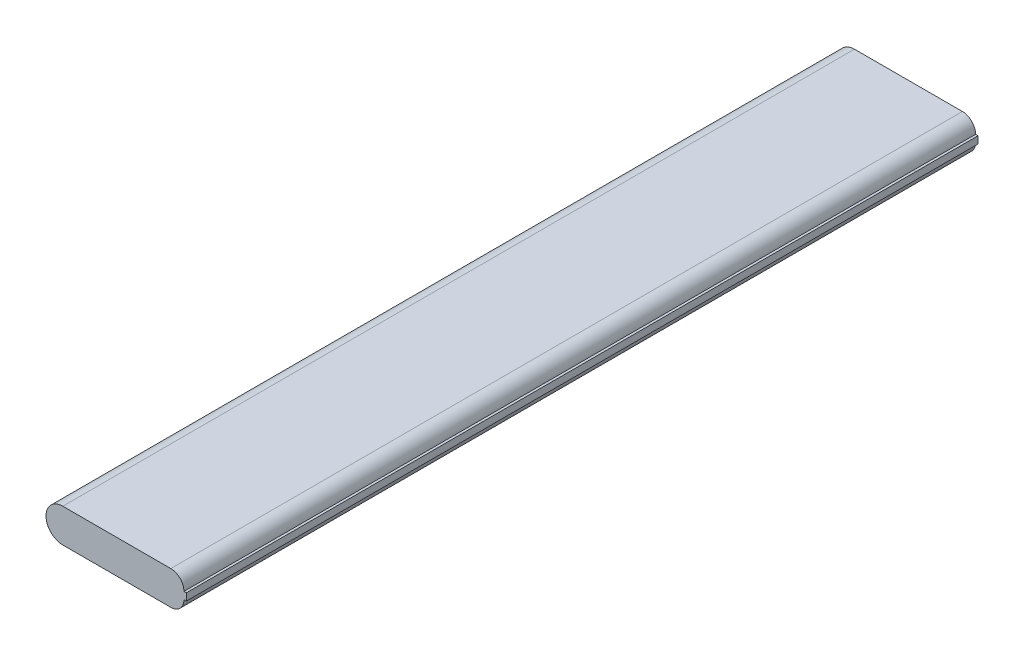
from build123d import *

# Parameters (mm, degrees)
BOSS_EXTRUDE1_DEPTH = 82.5


with BuildPart() as part:
    # Sketch1 → Boss-Extrude1 (new, symmetric)
    with BuildSketch(Plane.XY):
        with BuildLine():
            Line((-11.25, 3.5), (11.25, 3.5))
            ThreePointArc((11.25, 3.5), (13.194543648, 2.694543648), (14, 0.75))
            Line((14, 0.75), (14.5, 0.75))
            Line((14.5, 0.75), (14.5, -0.75))
            Line((14.5, -0.75), (14, -0.75))
            ThreePointArc((14, -0.75), (13.194543648, -2.694543648), (11.25, -3.5))
            Line((11.25, -3.5), (-11.25, -3.5))
            ThreePointArc((-11.25, -3.5), (-14.75, 0), (-11.25, 3.5))
        make_face()
    extrude(amount=BOSS_EXTRUDE1_DEPTH, both=True)


solid = part.part
